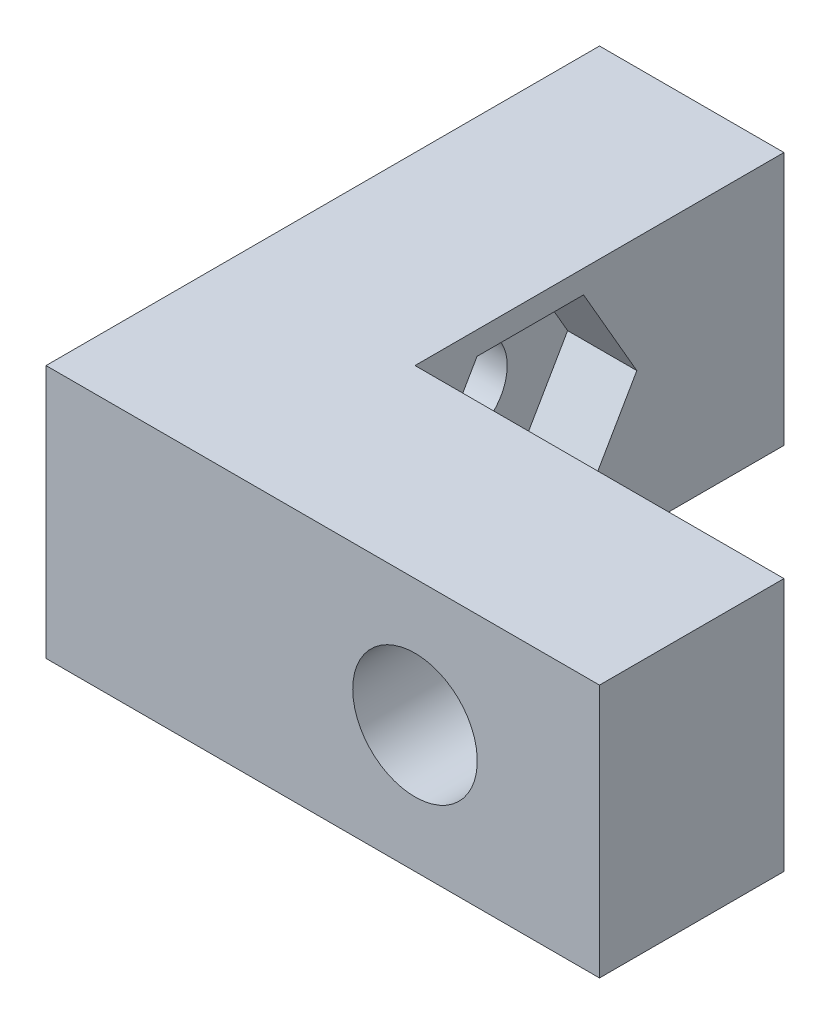
from build123d import *

# Parameters (mm, degrees)
EXTRUDE_1_DEPTH     = 5.5
CUT_EXTRUDE_1_REACH = 19.84
SKETCH_2_R          = 1
CUT_EXTRUDE_2_DEPTH = 1.5
CUT_EXTRUDE_3_REACH = 17.435
SKETCH_4_R          = 1.35


with BuildPart() as part:
    # 草图1 → 凸台-拉伸1 (new body)
    with BuildSketch(Plane(origin=(0, 0, 0), x_dir=(1, 0, 0), z_dir=(0, 1, 0))):
        Polygon((0, 0), (12, 0), (12, 4), (4, 4), (4, 12), (0, 12), align=None)
    extrude(amount=EXTRUDE_1_DEPTH)

    # 草图2 → 切除-拉伸1 (cut, up to next)
    with BuildSketch(Plane.ZY, mode=Mode.PRIVATE) as cut_extrude_1_sk1:
        with Locations((-6.5, 3)):
            Circle(SKETCH_2_R)
    cut_extrude_1_tool1 = extrude(cut_extrude_1_sk1.sketch, amount=-CUT_EXTRUDE_1_REACH, mode=Mode.PRIVATE) & part.part
    add(cut_extrude_1_tool1.solids().sort_by_distance((0, 3, -6.5))[0], mode=Mode.SUBTRACT)

    # 草图3 → 切除-拉伸2 (cut)
    with BuildSketch(Plane(origin=(4, 0, 0), x_dir=(0, 0, -1), z_dir=(1, 0, 0))):
        Polygon((8.809401077, 3), (7.654700538, 5), (5.345299462, 5), (4.190598923, 3), (5.345299462, 1), (7.654700538, 1), align=None)
    extrude(amount=-CUT_EXTRUDE_2_DEPTH, mode=Mode.SUBTRACT)

    # 草图4 → 切除-拉伸3 (cut, up to next)
    with BuildSketch(Plane(origin=(0, 0, -4), x_dir=(-1, 0, 0), z_dir=(0, 0, -1)), mode=Mode.PRIVATE) as cut_extrude_3_sk1:
        with Locations((-8, 2.75)):
            Circle(SKETCH_4_R)
    cut_extrude_3_tool1 = extrude(cut_extrude_3_sk1.sketch, amount=-CUT_EXTRUDE_3_REACH, mode=Mode.PRIVATE) & part.part
    add(cut_extrude_3_tool1.solids().sort_by_distance((8, 2.75, -4))[0], mode=Mode.SUBTRACT)


solid = part.part
